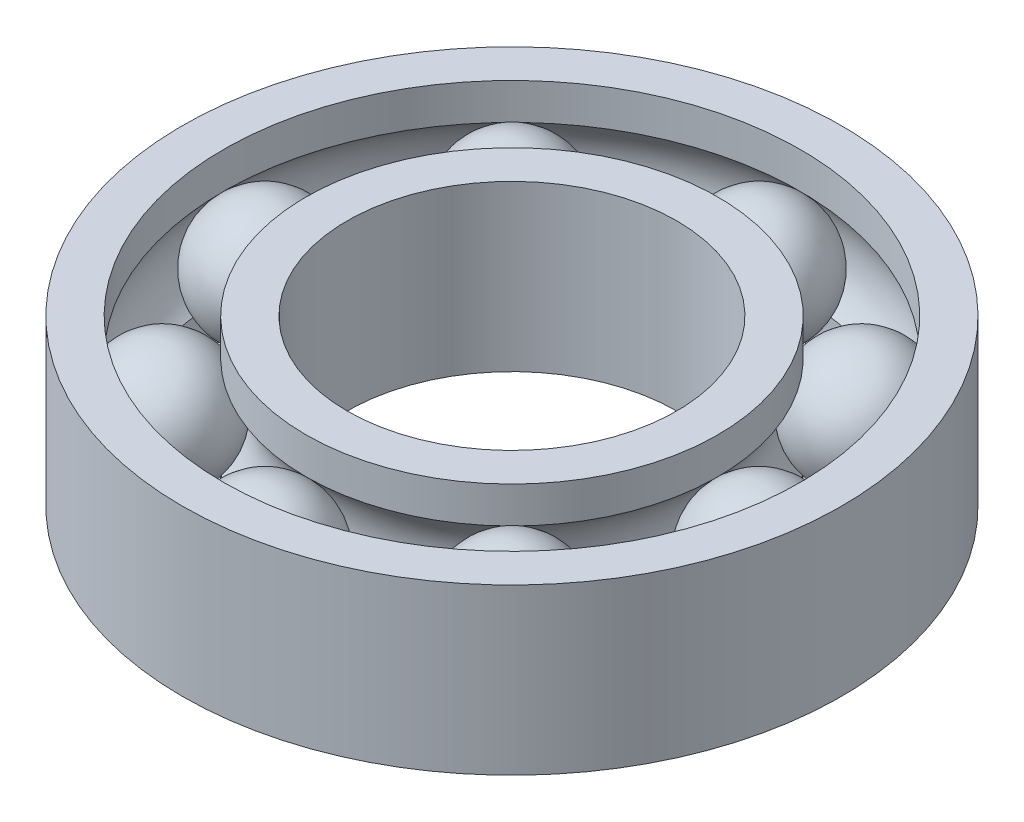
from build123d import *

# Parameters (mm, degrees)
CIRPATTERN1_COUNT = 8


with BuildPart() as part:
    # Sketch2 → Revolve14 (revolve)
    with BuildSketch(Plane.XY):
        with BuildLine():
            Line((-11.993785116, 3), (-11.993785116, -3))
            ThreePointArc((-11.993785116, -3), (-8.993785116, 0), (-11.993785116, 3))
        make_face()
    revolve(axis=Axis((-11.993785116, 3, 0), (0, -1, 0)))


with BuildPart() as body_2:
    # Sketch1 → Revolve15 (revolve)
    with BuildSketch(Plane.XY, mode=Mode.PRIVATE) as revolve15_sk:
        with BuildLine():
            Line((-14, 4), (-14, 2.236067977))
            ThreePointArc((-14, 2.236067977), (-15, 0), (-14, -2.236067977))
            Line((-14, -2.236067977), (-14, -4))
            Line((-14, -4), (-16, -4))
            Line((-16, -4), (-16, 4))
            Line((-16, 4), (-14, 4))
        make_face()
        with BuildLine():
            Line((-8, -4), (-8, 4))
            Line((-8, 4), (-10, 4))
            Line((-10, 4), (-10, 2.236067977))
            ThreePointArc((-10, 2.236067977), (-9, 0), (-10, -2.236067977))
            Line((-10, -2.236067977), (-10, -4))
            Line((-10, -4), (-8, -4))
        make_face()
    revolve(revolve15_sk.sketch.rotate(Axis((0, 8.8, 0), (0, -1, 0)), 270), axis=Axis((0, 8.8, 0), (0, -1, 0)))


with BuildPart() as cirpattern1_1:
    # CirPattern1: pattern copy
    add(part.part.rotate(Axis((0, 0, 0), (0, 1, 0)), 1 * 360 / CIRPATTERN1_COUNT))


with BuildPart() as cirpattern1_2:
    # CirPattern1: pattern copy
    add(part.part.rotate(Axis((0, 0, 0), (0, 1, 0)), 2 * 360 / CIRPATTERN1_COUNT))


with BuildPart() as cirpattern1_3:
    # CirPattern1: pattern copy
    add(part.part.rotate(Axis((0, 0, 0), (0, 1, 0)), 3 * 360 / CIRPATTERN1_COUNT))


with BuildPart() as cirpattern1_4:
    # CirPattern1: pattern copy
    add(part.part.rotate(Axis((0, 0, 0), (0, 1, 0)), 4 * 360 / CIRPATTERN1_COUNT))


with BuildPart() as cirpattern1_5:
    # CirPattern1: pattern copy
    add(part.part.rotate(Axis((0, 0, 0), (0, 1, 0)), 5 * 360 / CIRPATTERN1_COUNT))


with BuildPart() as cirpattern1_6:
    # CirPattern1: pattern copy
    add(part.part.rotate(Axis((0, 0, 0), (0, 1, 0)), 6 * 360 / CIRPATTERN1_COUNT))


with BuildPart() as cirpattern1_7:
    # CirPattern1: pattern copy
    add(part.part.rotate(Axis((0, 0, 0), (0, 1, 0)), 7 * 360 / CIRPATTERN1_COUNT))


solid = Compound([part.part, body_2.part, cirpattern1_1.part, cirpattern1_2.part, cirpattern1_3.part, cirpattern1_4.part, cirpattern1_5.part, cirpattern1_6.part, cirpattern1_7.part])
